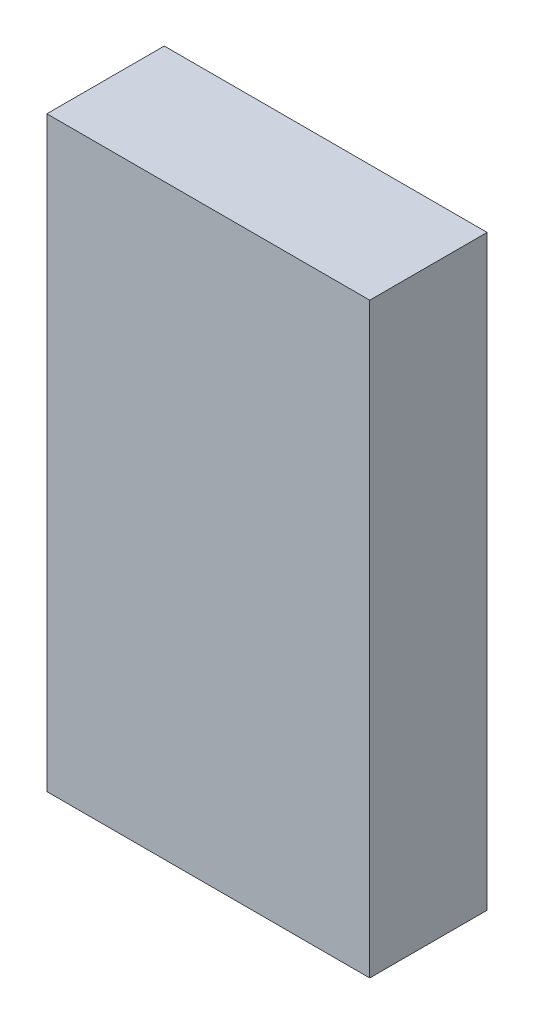
from build123d import *

# Parameters (mm, degrees)
SKETCH1_W           = 55
SKETCH1_H           = 100
BOSS_EXTRUDE1_DEPTH = 20


with BuildPart() as part:
    # Sketch1 → Boss-Extrude1 (new body)
    with BuildSketch(Plane.XY):
        Rectangle(SKETCH1_W, SKETCH1_H)
    extrude(amount=BOSS_EXTRUDE1_DEPTH)


solid = part.part
